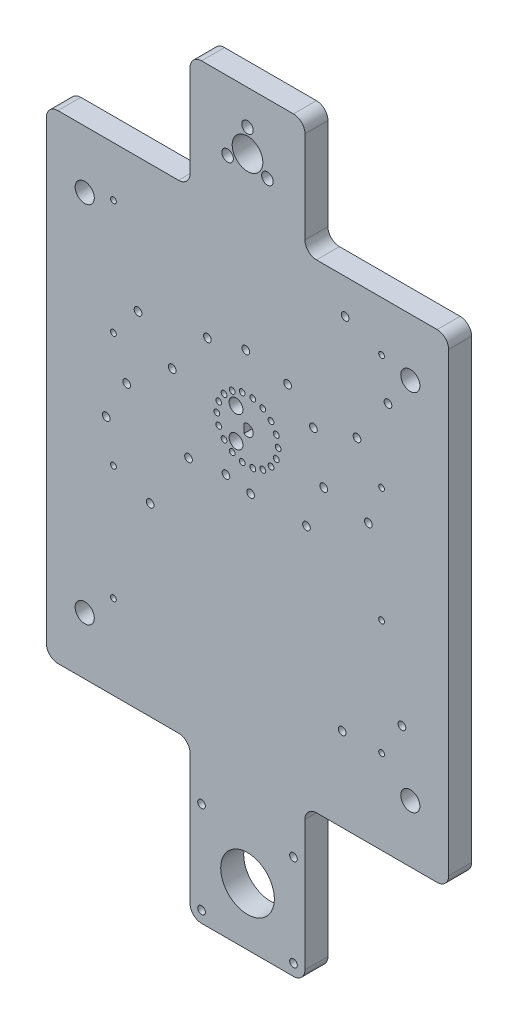
from build123d import *

# Parameters (mm, degrees)
SKETCH_1_W                      = 105
SKETCH_1_H                      = 125
EXTRUDE_1_DEPTH                 = 6
CUT_EXTRUDE_1_REACH             = 165.359
SKETCH_2_R                      = 0.75
FILLET_1_R                      = 3
CUT_EXTRUDE_2_REACH             = 165.359
SKETCH_3_R                      = 1.8
CUT_EXTRUDE_2_DIRECTION_2_DEPTH = 164.358501462
CUT_EXTRUDE1_DEPTH              = 164.358501462
CUT_EXTRUDE1_DEPTH_BACK         = 164.358501462
SKETCH1_R                       = 0.75
CUT_EXTRUDE2_REACH              = 165.359
SKETCH2_R                       = 1
BOSS_EXTRUDE1_DEPTH             = 6
CUT_EXTRUDE3_REACH              = 197.668
SKETCH4_R                       = 4
SKETCH4_R_2                     = 1.5
FILLET1_R                       = 3
CUT_EXTRUDE4_REACH              = 197.668
SKETCH5_R                       = 2.5
CUT_EXTRUDE5_REACH              = 197.668
SKETCH6_R                       = 1
SKETCH6_R_2                     = 7
FILLET2_R                       = 3


with BuildPart() as part:
    # 草图1 → 凸台-拉伸1 (new body)
    with BuildSketch(Plane.XY):
        with Locations((52.5, -62.5)):
            Rectangle(SKETCH_1_W, SKETCH_1_H)
    extrude(amount=EXTRUDE_1_DEPTH)

    # 草图2 → 切除-拉伸1 (cut, up to next)
    with BuildSketch(Plane.XY.offset(6), mode=Mode.PRIVATE) as cut_extrude_1_sk1:
        with Locations((17.5, -13)):
            Circle(SKETCH_2_R)
    cut_extrude_1_tool1 = extrude(cut_extrude_1_sk1.sketch, amount=-CUT_EXTRUDE_1_REACH, mode=Mode.PRIVATE) & part.part
    # 草图2 → 切除-拉伸1 (cut, up to next)
    with BuildSketch(Plane.XY.offset(6), mode=Mode.PRIVATE) as cut_extrude_1_sk2:
        with Locations((87.5, -13)):
            Circle(SKETCH_2_R)
    cut_extrude_1_tool2 = extrude(cut_extrude_1_sk2.sketch, amount=-CUT_EXTRUDE_1_REACH, mode=Mode.PRIVATE) & part.part
    # 草图2 → 切除-拉伸1 (cut, up to next)
    with BuildSketch(Plane.XY.offset(6), mode=Mode.PRIVATE) as cut_extrude_1_sk3:
        with Locations((87.5, -43)):
            Circle(SKETCH_2_R)
    cut_extrude_1_tool3 = extrude(cut_extrude_1_sk3.sketch, amount=-CUT_EXTRUDE_1_REACH, mode=Mode.PRIVATE) & part.part
    # 草图2 → 切除-拉伸1 (cut, up to next)
    with BuildSketch(Plane.XY.offset(6), mode=Mode.PRIVATE) as cut_extrude_1_sk4:
        with Locations((87.5, -73)):
            Circle(SKETCH_2_R)
    cut_extrude_1_tool4 = extrude(cut_extrude_1_sk4.sketch, amount=-CUT_EXTRUDE_1_REACH, mode=Mode.PRIVATE) & part.part
    # 草图2 → 切除-拉伸1 (cut, up to next)
    with BuildSketch(Plane.XY.offset(6), mode=Mode.PRIVATE) as cut_extrude_1_sk5:
        with Locations((87.5, -103)):
            Circle(SKETCH_2_R)
    cut_extrude_1_tool5 = extrude(cut_extrude_1_sk5.sketch, amount=-CUT_EXTRUDE_1_REACH, mode=Mode.PRIVATE) & part.part
    # 草图2 → 切除-拉伸1 (cut, up to next)
    with BuildSketch(Plane.XY.offset(6), mode=Mode.PRIVATE) as cut_extrude_1_sk6:
        with Locations((17.5, -43)):
            Circle(SKETCH_2_R)
    cut_extrude_1_tool6 = extrude(cut_extrude_1_sk6.sketch, amount=-CUT_EXTRUDE_1_REACH, mode=Mode.PRIVATE) & part.part
    # 草图2 → 切除-拉伸1 (cut, up to next)
    with BuildSketch(Plane.XY.offset(6), mode=Mode.PRIVATE) as cut_extrude_1_sk7:
        with Locations((17.5, -73)):
            Circle(SKETCH_2_R)
    cut_extrude_1_tool7 = extrude(cut_extrude_1_sk7.sketch, amount=-CUT_EXTRUDE_1_REACH, mode=Mode.PRIVATE) & part.part
    # 草图2 → 切除-拉伸1 (cut, up to next)
    with BuildSketch(Plane.XY.offset(6), mode=Mode.PRIVATE) as cut_extrude_1_sk8:
        with Locations((17.5, -103)):
            Circle(SKETCH_2_R)
    cut_extrude_1_tool8 = extrude(cut_extrude_1_sk8.sketch, amount=-CUT_EXTRUDE_1_REACH, mode=Mode.PRIVATE) & part.part
    add(cut_extrude_1_tool1.solids().sort_by_distance((17.5, -13, 6))[0], mode=Mode.SUBTRACT)
    add(cut_extrude_1_tool2.solids().sort_by_distance((87.5, -13, 6))[0], mode=Mode.SUBTRACT)
    add(cut_extrude_1_tool3.solids().sort_by_distance((87.5, -43, 6))[0], mode=Mode.SUBTRACT)
    add(cut_extrude_1_tool4.solids().sort_by_distance((87.5, -73, 6))[0], mode=Mode.SUBTRACT)
    add(cut_extrude_1_tool5.solids().sort_by_distance((87.5, -103, 6))[0], mode=Mode.SUBTRACT)
    add(cut_extrude_1_tool6.solids().sort_by_distance((17.5, -43, 6))[0], mode=Mode.SUBTRACT)
    add(cut_extrude_1_tool7.solids().sort_by_distance((17.5, -73, 6))[0], mode=Mode.SUBTRACT)
    add(cut_extrude_1_tool8.solids().sort_by_distance((17.5, -103, 6))[0], mode=Mode.SUBTRACT)

    # 圆角1
    fillet_1_edges = [part.edges().sort_by_distance(p)[0] for p in [
        (0, 0, 3),
        (105, 0, 3),
        (105, -125, 3),
        (0, -125, 3),
    ]]
    fillet(fillet_1_edges, radius=FILLET_1_R)

    # 草图3 → 切除-拉伸2 (cut, up to next)
    with BuildSketch(Plane.XY.offset(6), mode=Mode.PRIVATE) as cut_extrude_2_sk1:
        with Locations(Location((49.5, -43.5, 0), (0, 0, 180))):
            Circle(SKETCH_3_R)
    cut_extrude_2_tool1 = extrude(cut_extrude_2_sk1.sketch, amount=-CUT_EXTRUDE_2_REACH, mode=Mode.PRIVATE) & part.part
    # 草图3 → 切除-拉伸2 (cut, up to next)
    with BuildSketch(Plane.XY.offset(6), mode=Mode.PRIVATE) as cut_extrude_2_sk2:
        with Locations(Location((49.5, -51.5, 0), (0, 0, 180))):
            Circle(SKETCH_3_R)
    cut_extrude_2_tool2 = extrude(cut_extrude_2_sk2.sketch, amount=-CUT_EXTRUDE_2_REACH, mode=Mode.PRIVATE) & part.part
    # 草图3 → 切除-拉伸2 (cut, up to next)
    with BuildSketch(Plane.XY.offset(6), mode=Mode.PRIVATE) as cut_extrude_2_sk3:
        with BuildLine():
            Line((51.6, -46.3), (51.6, -48.7))
            ThreePointArc((51.6, -48.7), (54, -47.5), (51.6, -46.3))
        make_face()
    cut_extrude_2_tool3 = extrude(cut_extrude_2_sk3.sketch, amount=-CUT_EXTRUDE_2_REACH, mode=Mode.PRIVATE) & part.part
    add(cut_extrude_2_tool1.solids().sort_by_distance((49.5, -43.5, 6))[0], mode=Mode.SUBTRACT)
    add(cut_extrude_2_tool2.solids().sort_by_distance((49.5, -51.5, 6))[0], mode=Mode.SUBTRACT)
    add(cut_extrude_2_tool3.solids().sort_by_distance((52.690031, -47.5, 6))[0], mode=Mode.SUBTRACT)

    # 草图3 → 切除-拉伸2 direction 2 (cut)
    with BuildSketch(Plane.XY.offset(6)):
        with Locations(Location((49.5, -43.5, 0), (0, 0, 180))):
            Circle(SKETCH_3_R)
        with Locations(Location((49.5, -51.5, 0), (0, 0, 180))):
            Circle(SKETCH_3_R)
        with BuildLine():
            Line((51.6, -46.3), (51.6, -48.7))
            ThreePointArc((51.6, -48.7), (54, -47.5), (51.6, -46.3))
        make_face()
    extrude(amount=CUT_EXTRUDE_2_DIRECTION_2_DEPTH, mode=Mode.SUBTRACT)

    # Sketch1 → Cut-Extrude1 (cut, two sides: drawn at the far end of the back side and taken through both)
    with BuildSketch(Plane.XY.offset(6).offset(-CUT_EXTRUDE1_DEPTH_BACK)):
        with Locations((60.5, -47.5)):
            Circle(SKETCH1_R)
        with Locations((60.017540966, -50.236161147)):
            Circle(SKETCH1_R)
        with Locations((58.628355545, -52.642300877)):
            Circle(SKETCH1_R)
        with Locations((56.5, -54.42820323)):
            Circle(SKETCH1_R)
        with Locations((53.889185421, -55.378462024)):
            Circle(SKETCH1_R)
        with Locations((51.110814579, -55.378462024)):
            Circle(SKETCH1_R)
        with Locations((48.5, -54.42820323)):
            Circle(SKETCH1_R)
        with Locations((46.371644455, -52.642300877)):
            Circle(SKETCH1_R)
        with Locations((44.982459034, -50.236161147)):
            Circle(SKETCH1_R)
        with Locations((44.5, -47.5)):
            Circle(SKETCH1_R)
        with Locations((44.982459034, -44.763838853)):
            Circle(SKETCH1_R)
        with Locations((46.371644455, -42.357699123)):
            Circle(SKETCH1_R)
        with Locations((48.5, -40.57179677)):
            Circle(SKETCH1_R)
        with Locations((51.110814579, -39.621537976)):
            Circle(SKETCH1_R)
        with Locations((53.889185421, -39.621537976)):
            Circle(SKETCH1_R)
        with Locations((56.5, -40.57179677)):
            Circle(SKETCH1_R)
        with Locations((58.628355545, -42.357699123)):
            Circle(SKETCH1_R)
        with Locations((60.017540966, -44.763838853)):
            Circle(SKETCH1_R)
    extrude(amount=CUT_EXTRUDE1_DEPTH + CUT_EXTRUDE1_DEPTH_BACK, mode=Mode.SUBTRACT)

    # Sketch2 → Cut-Extrude2 (cut, up to next)
    with BuildSketch(Plane(origin=(0, 0, 0), x_dir=(-1, 0, 0), z_dir=(0, 0, -1)), mode=Mode.PRIVATE) as cut_extrude2_sk1:
        with Locations((-52.067615127, -29.585989519)):
            Circle(SKETCH2_R)
    cut_extrude2_tool1 = extrude(cut_extrude2_sk1.sketch, amount=-CUT_EXTRUDE2_REACH, mode=Mode.PRIVATE) & part.part
    # Sketch2 → Cut-Extrude2 (cut, up to next)
    with BuildSketch(Plane(origin=(0, 0, 0), x_dir=(-1, 0, 0), z_dir=(0, 0, -1)), mode=Mode.PRIVATE) as cut_extrude2_sk2:
        with Locations((-77.992506667, -9.049358214)):
            Circle(SKETCH2_R)
    cut_extrude2_tool2 = extrude(cut_extrude2_sk2.sketch, amount=-CUT_EXTRUDE2_REACH, mode=Mode.PRIVATE) & part.part
    # Sketch2 → Cut-Extrude2 (cut, up to next)
    with BuildSketch(Plane(origin=(0, 0, 0), x_dir=(-1, 0, 0), z_dir=(0, 0, -1)), mode=Mode.PRIVATE) as cut_extrude2_sk3:
        with Locations((-89.168508169, -23.159531509)):
            Circle(SKETCH2_R)
    cut_extrude2_tool3 = extrude(cut_extrude2_sk3.sketch, amount=-CUT_EXTRUDE2_REACH, mode=Mode.PRIVATE) & part.part
    # Sketch2 → Cut-Extrude2 (cut, up to next)
    with BuildSketch(Plane(origin=(0, 0, 0), x_dir=(-1, 0, 0), z_dir=(0, 0, -1)), mode=Mode.PRIVATE) as cut_extrude2_sk4:
        with Locations((-15.609550232, -62.879417029)):
            Circle(SKETCH2_R)
    cut_extrude2_tool4 = extrude(cut_extrude2_sk4.sketch, amount=-CUT_EXTRUDE2_REACH, mode=Mode.PRIVATE) & part.part
    # Sketch2 → Cut-Extrude2 (cut, up to next)
    with BuildSketch(Plane(origin=(0, 0, 0), x_dir=(-1, 0, 0), z_dir=(0, 0, -1)), mode=Mode.PRIVATE) as cut_extrude2_sk5:
        with Locations((-27.091675985, -76.741624219)):
            Circle(SKETCH2_R)
    cut_extrude2_tool5 = extrude(cut_extrude2_sk5.sketch, amount=-CUT_EXTRUDE2_REACH, mode=Mode.PRIVATE) & part.part
    # Sketch2 → Cut-Extrude2 (cut, up to next)
    with BuildSketch(Plane(origin=(0, 0, 0), x_dir=(-1, 0, 0), z_dir=(0, 0, -1)), mode=Mode.PRIVATE) as cut_extrude2_sk6:
        with Locations((-46.872908802, -60.356744118)):
            Circle(SKETCH2_R)
    cut_extrude2_tool6 = extrude(cut_extrude2_sk6.sketch, amount=-CUT_EXTRUDE2_REACH, mode=Mode.PRIVATE) & part.part
    # Sketch2 → Cut-Extrude2 (cut, up to next)
    with BuildSketch(Plane(origin=(0, 0, 0), x_dir=(-1, 0, 0), z_dir=(0, 0, -1)), mode=Mode.PRIVATE) as cut_extrude2_sk7:
        with Locations((-53.307488675, -61.456401839)):
            Circle(SKETCH2_R)
    cut_extrude2_tool7 = extrude(cut_extrude2_sk7.sketch, amount=-CUT_EXTRUDE2_REACH, mode=Mode.PRIVATE) & part.part
    # Sketch2 → Cut-Extrude2 (cut, up to next)
    with BuildSketch(Plane(origin=(0, 0, 0), x_dir=(-1, 0, 0), z_dir=(0, 0, -1)), mode=Mode.PRIVATE) as cut_extrude2_sk8:
        with Locations((-92.82086687, -94.185899039)):
            Circle(SKETCH2_R)
    cut_extrude2_tool8 = extrude(cut_extrude2_sk8.sketch, amount=-CUT_EXTRUDE2_REACH, mode=Mode.PRIVATE) & part.part
    # Sketch2 → Cut-Extrude2 (cut, up to next)
    with BuildSketch(Plane(origin=(0, 0, 0), x_dir=(-1, 0, 0), z_dir=(0, 0, -1)), mode=Mode.PRIVATE) as cut_extrude2_sk9:
        with Locations((-77.205305366, -103.138789015)):
            Circle(SKETCH2_R)
    cut_extrude2_tool9 = extrude(cut_extrude2_sk9.sketch, amount=-CUT_EXTRUDE2_REACH, mode=Mode.PRIVATE) & part.part
    # Sketch2 → Cut-Extrude2 (cut, up to next)
    with BuildSketch(Plane(origin=(0, 0, 0), x_dir=(-1, 0, 0), z_dir=(0, 0, -1)), mode=Mode.PRIVATE) as cut_extrude2_sk10:
        with Locations((-81.088439495, -34.944449622)):
            Circle(SKETCH2_R)
    cut_extrude2_tool10 = extrude(cut_extrude2_sk10.sketch, amount=-CUT_EXTRUDE2_REACH, mode=Mode.PRIVATE) & part.part
    # Sketch2 → Cut-Extrude2 (cut, up to next)
    with BuildSketch(Plane(origin=(0, 0, 0), x_dir=(-1, 0, 0), z_dir=(0, 0, -1)), mode=Mode.PRIVATE) as cut_extrude2_sk11:
        with Locations((-84.047621267, -52.699540251)):
            Circle(SKETCH2_R)
    cut_extrude2_tool11 = extrude(cut_extrude2_sk11.sketch, amount=-CUT_EXTRUDE2_REACH, mode=Mode.PRIVATE) & part.part
    # Sketch2 → Cut-Extrude2 (cut, up to next)
    with BuildSketch(Plane(origin=(0, 0, 0), x_dir=(-1, 0, 0), z_dir=(0, 0, -1)), mode=Mode.PRIVATE) as cut_extrude2_sk12:
        with Locations((-23.911560505, -34.944449622)):
            Circle(SKETCH2_R)
    cut_extrude2_tool12 = extrude(cut_extrude2_sk12.sketch, amount=-CUT_EXTRUDE2_REACH, mode=Mode.PRIVATE) & part.part
    # Sketch2 → Cut-Extrude2 (cut, up to next)
    with BuildSketch(Plane(origin=(0, 0, 0), x_dir=(-1, 0, 0), z_dir=(0, 0, -1)), mode=Mode.PRIVATE) as cut_extrude2_sk13:
        with Locations((-20.952378733, -52.699540251)):
            Circle(SKETCH2_R)
    cut_extrude2_tool13 = extrude(cut_extrude2_sk13.sketch, amount=-CUT_EXTRUDE2_REACH, mode=Mode.PRIVATE) & part.part
    # Sketch2 → Cut-Extrude2 (cut, up to next)
    with BuildSketch(Plane(origin=(0, 0, 0), x_dir=(-1, 0, 0), z_dir=(0, 0, -1)), mode=Mode.PRIVATE) as cut_extrude2_sk14:
        with Locations((-62.96598481, -31.882096206)):
            Circle(SKETCH2_R)
    cut_extrude2_tool14 = extrude(cut_extrude2_sk14.sketch, amount=-CUT_EXTRUDE2_REACH, mode=Mode.PRIVATE) & part.part
    # Sketch2 → Cut-Extrude2 (cut, up to next)
    with BuildSketch(Plane(origin=(0, 0, 0), x_dir=(-1, 0, 0), z_dir=(0, 0, -1)), mode=Mode.PRIVATE) as cut_extrude2_sk15:
        with Locations((-67.897954429, -61.473913921)):
            Circle(SKETCH2_R)
    cut_extrude2_tool15 = extrude(cut_extrude2_sk15.sketch, amount=-CUT_EXTRUDE2_REACH, mode=Mode.PRIVATE) & part.part
    # Sketch2 → Cut-Extrude2 (cut, up to next)
    with BuildSketch(Plane(origin=(0, 0, 0), x_dir=(-1, 0, 0), z_dir=(0, 0, -1)), mode=Mode.PRIVATE) as cut_extrude2_sk16:
        with Locations((-42.03401519, -31.882096206)):
            Circle(SKETCH2_R)
    cut_extrude2_tool16 = extrude(cut_extrude2_sk16.sketch, amount=-CUT_EXTRUDE2_REACH, mode=Mode.PRIVATE) & part.part
    # Sketch2 → Cut-Extrude2 (cut, up to next)
    with BuildSketch(Plane(origin=(0, 0, 0), x_dir=(-1, 0, 0), z_dir=(0, 0, -1)), mode=Mode.PRIVATE) as cut_extrude2_sk17:
        with Locations((-37.102045571, -61.473913921)):
            Circle(SKETCH2_R)
    cut_extrude2_tool17 = extrude(cut_extrude2_sk17.sketch, amount=-CUT_EXTRUDE2_REACH, mode=Mode.PRIVATE) & part.part
    # Sketch2 → Cut-Extrude2 (cut, up to next)
    with BuildSketch(Plane(origin=(0, 0, 0), x_dir=(-1, 0, 0), z_dir=(0, 0, -1)), mode=Mode.PRIVATE) as cut_extrude2_sk18:
        with Locations((-72.404748825, -50.534212943)):
            Circle(SKETCH2_R)
    cut_extrude2_tool18 = extrude(cut_extrude2_sk18.sketch, amount=-CUT_EXTRUDE2_REACH, mode=Mode.PRIVATE) & part.part
    # Sketch2 → Cut-Extrude2 (cut, up to next)
    with BuildSketch(Plane(origin=(0, 0, 0), x_dir=(-1, 0, 0), z_dir=(0, 0, -1)), mode=Mode.PRIVATE) as cut_extrude2_sk19:
        with Locations((-32.839199548, -43.414046441)):
            Circle(SKETCH2_R)
    cut_extrude2_tool19 = extrude(cut_extrude2_sk19.sketch, amount=-CUT_EXTRUDE2_REACH, mode=Mode.PRIVATE) & part.part
    # Sketch2 → Cut-Extrude2 (cut, up to next)
    with BuildSketch(Plane(origin=(0, 0, 0), x_dir=(-1, 0, 0), z_dir=(0, 0, -1)), mode=Mode.PRIVATE) as cut_extrude2_sk20:
        with Locations((-69.710721853, -38.345029708)):
            Circle(SKETCH2_R)
    cut_extrude2_tool20 = extrude(cut_extrude2_sk20.sketch, amount=-CUT_EXTRUDE2_REACH, mode=Mode.PRIVATE) & part.part
    add(cut_extrude2_tool1.solids().sort_by_distance((52.067615, -29.58599, 0))[0], mode=Mode.SUBTRACT)
    add(cut_extrude2_tool2.solids().sort_by_distance((77.992507, -9.049358, 0))[0], mode=Mode.SUBTRACT)
    add(cut_extrude2_tool3.solids().sort_by_distance((89.168508, -23.159532, 0))[0], mode=Mode.SUBTRACT)
    add(cut_extrude2_tool4.solids().sort_by_distance((15.60955, -62.879417, 0))[0], mode=Mode.SUBTRACT)
    add(cut_extrude2_tool5.solids().sort_by_distance((27.091676, -76.741624, 0))[0], mode=Mode.SUBTRACT)
    add(cut_extrude2_tool6.solids().sort_by_distance((46.872909, -60.356744, 0))[0], mode=Mode.SUBTRACT)
    add(cut_extrude2_tool7.solids().sort_by_distance((53.307489, -61.456402, 0))[0], mode=Mode.SUBTRACT)
    add(cut_extrude2_tool8.solids().sort_by_distance((92.820867, -94.185899, 0))[0], mode=Mode.SUBTRACT)
    add(cut_extrude2_tool9.solids().sort_by_distance((77.205305, -103.138789, 0))[0], mode=Mode.SUBTRACT)
    add(cut_extrude2_tool10.solids().sort_by_distance((81.088439, -34.94445, 0))[0], mode=Mode.SUBTRACT)
    add(cut_extrude2_tool11.solids().sort_by_distance((84.047621, -52.69954, 0))[0], mode=Mode.SUBTRACT)
    add(cut_extrude2_tool12.solids().sort_by_distance((23.911561, -34.94445, 0))[0], mode=Mode.SUBTRACT)
    add(cut_extrude2_tool13.solids().sort_by_distance((20.952379, -52.69954, 0))[0], mode=Mode.SUBTRACT)
    add(cut_extrude2_tool14.solids().sort_by_distance((62.965985, -31.882096, 0))[0], mode=Mode.SUBTRACT)
    add(cut_extrude2_tool15.solids().sort_by_distance((67.897954, -61.473914, 0))[0], mode=Mode.SUBTRACT)
    add(cut_extrude2_tool16.solids().sort_by_distance((42.034015, -31.882096, 0))[0], mode=Mode.SUBTRACT)
    add(cut_extrude2_tool17.solids().sort_by_distance((37.102046, -61.473914, 0))[0], mode=Mode.SUBTRACT)
    add(cut_extrude2_tool18.solids().sort_by_distance((72.404749, -50.534213, 0))[0], mode=Mode.SUBTRACT)
    add(cut_extrude2_tool19.solids().sort_by_distance((32.8392, -43.414046, 0))[0], mode=Mode.SUBTRACT)
    add(cut_extrude2_tool20.solids().sort_by_distance((69.710722, -38.34503, 0))[0], mode=Mode.SUBTRACT)

    # Sketch3 → Boss-Extrude1 (add)
    with BuildSketch(Plane(origin=(0, 0, 0), x_dir=(-1, 0, 0), z_dir=(0, 0, -1))):
        Polygon((-52.5, 0), (-37.5, 0), (-37.5, 30), (-67.5, 30), (-67.5, 0), align=None)
        Polygon((-52.5, -125), (-37.5, -125), (-37.5, -165), (-67.5, -165), (-67.5, -125), align=None)
    extrude(amount=-BOSS_EXTRUDE1_DEPTH)

    # Sketch4 → Cut-Extrude3 (cut, up to next)
    with BuildSketch(Plane(origin=(0, 0, 0), x_dir=(-1, 0, 0), z_dir=(0, 0, -1)), mode=Mode.PRIVATE) as cut_extrude3_sk1:
        with Locations((-52.5, 15)):
            Circle(SKETCH4_R)
    cut_extrude3_tool1 = extrude(cut_extrude3_sk1.sketch, amount=-CUT_EXTRUDE3_REACH, mode=Mode.PRIVATE) & part.part
    # Sketch4 → Cut-Extrude3 (cut, up to next)
    with BuildSketch(Plane(origin=(0, 0, 0), x_dir=(-1, 0, 0), z_dir=(0, 0, -1)), mode=Mode.PRIVATE) as cut_extrude3_sk2:
        with Locations((-52.5, 21)):
            Circle(SKETCH4_R_2)
    cut_extrude3_tool2 = extrude(cut_extrude3_sk2.sketch, amount=-CUT_EXTRUDE3_REACH, mode=Mode.PRIVATE) & part.part
    # Sketch4 → Cut-Extrude3 (cut, up to next)
    with BuildSketch(Plane(origin=(0, 0, 0), x_dir=(-1, 0, 0), z_dir=(0, 0, -1)), mode=Mode.PRIVATE) as cut_extrude3_sk3:
        with Locations((-47.303847577, 12)):
            Circle(SKETCH4_R_2)
    cut_extrude3_tool3 = extrude(cut_extrude3_sk3.sketch, amount=-CUT_EXTRUDE3_REACH, mode=Mode.PRIVATE) & part.part
    # Sketch4 → Cut-Extrude3 (cut, up to next)
    with BuildSketch(Plane(origin=(0, 0, 0), x_dir=(-1, 0, 0), z_dir=(0, 0, -1)), mode=Mode.PRIVATE) as cut_extrude3_sk4:
        with Locations((-57.696152423, 12)):
            Circle(SKETCH4_R_2)
    cut_extrude3_tool4 = extrude(cut_extrude3_sk4.sketch, amount=-CUT_EXTRUDE3_REACH, mode=Mode.PRIVATE) & part.part
    add(cut_extrude3_tool1.solids().sort_by_distance((52.5, 15, 0))[0], mode=Mode.SUBTRACT)
    add(cut_extrude3_tool2.solids().sort_by_distance((52.5, 21, 0))[0], mode=Mode.SUBTRACT)
    add(cut_extrude3_tool3.solids().sort_by_distance((47.303848, 12, 0))[0], mode=Mode.SUBTRACT)
    add(cut_extrude3_tool4.solids().sort_by_distance((57.696152, 12, 0))[0], mode=Mode.SUBTRACT)

    # Fillet1
    fillet1_edges = [part.edges().sort_by_distance(p)[0] for p in [
        (67.5, 0, 3),
        (67.5, 30, 3),
        (37.5, 30, 3),
        (37.5, 0, 3),
    ]]
    fillet(fillet1_edges, radius=FILLET1_R)

    # Sketch5 → Cut-Extrude4 (cut, up to next)
    with BuildSketch(Plane(origin=(0, 0, 0), x_dir=(-1, 0, 0), z_dir=(0, 0, -1)), mode=Mode.PRIVATE) as cut_extrude4_sk1:
        with Locations((-95, -15)):
            Circle(SKETCH5_R)
    cut_extrude4_tool1 = extrude(cut_extrude4_sk1.sketch, amount=-CUT_EXTRUDE4_REACH, mode=Mode.PRIVATE) & part.part
    # Sketch5 → Cut-Extrude4 (cut, up to next)
    with BuildSketch(Plane(origin=(0, 0, 0), x_dir=(-1, 0, 0), z_dir=(0, 0, -1)), mode=Mode.PRIVATE) as cut_extrude4_sk2:
        with Locations((-95, -110)):
            Circle(SKETCH5_R)
    cut_extrude4_tool2 = extrude(cut_extrude4_sk2.sketch, amount=-CUT_EXTRUDE4_REACH, mode=Mode.PRIVATE) & part.part
    # Sketch5 → Cut-Extrude4 (cut, up to next)
    with BuildSketch(Plane(origin=(0, 0, 0), x_dir=(-1, 0, 0), z_dir=(0, 0, -1)), mode=Mode.PRIVATE) as cut_extrude4_sk3:
        with Locations((-10, -15)):
            Circle(SKETCH5_R)
    cut_extrude4_tool3 = extrude(cut_extrude4_sk3.sketch, amount=-CUT_EXTRUDE4_REACH, mode=Mode.PRIVATE) & part.part
    # Sketch5 → Cut-Extrude4 (cut, up to next)
    with BuildSketch(Plane(origin=(0, 0, 0), x_dir=(-1, 0, 0), z_dir=(0, 0, -1)), mode=Mode.PRIVATE) as cut_extrude4_sk4:
        with Locations((-10, -110)):
            Circle(SKETCH5_R)
    cut_extrude4_tool4 = extrude(cut_extrude4_sk4.sketch, amount=-CUT_EXTRUDE4_REACH, mode=Mode.PRIVATE) & part.part
    add(cut_extrude4_tool1.solids().sort_by_distance((95, -15, 0))[0], mode=Mode.SUBTRACT)
    add(cut_extrude4_tool2.solids().sort_by_distance((95, -110, 0))[0], mode=Mode.SUBTRACT)
    add(cut_extrude4_tool3.solids().sort_by_distance((10, -15, 0))[0], mode=Mode.SUBTRACT)
    add(cut_extrude4_tool4.solids().sort_by_distance((10, -110, 0))[0], mode=Mode.SUBTRACT)

    # Sketch6 → Cut-Extrude5 (cut, up to next)
    with BuildSketch(Plane(origin=(0, 0, 0), x_dir=(-1, 0, 0), z_dir=(0, 0, -1)), mode=Mode.PRIVATE) as cut_extrude5_sk1:
        with Locations((-64.5, -138)):
            Circle(SKETCH6_R)
    cut_extrude5_tool1 = extrude(cut_extrude5_sk1.sketch, amount=-CUT_EXTRUDE5_REACH, mode=Mode.PRIVATE) & part.part
    # Sketch6 → Cut-Extrude5 (cut, up to next)
    with BuildSketch(Plane(origin=(0, 0, 0), x_dir=(-1, 0, 0), z_dir=(0, 0, -1)), mode=Mode.PRIVATE) as cut_extrude5_sk2:
        with Locations((-40.5, -138)):
            Circle(SKETCH6_R)
    cut_extrude5_tool2 = extrude(cut_extrude5_sk2.sketch, amount=-CUT_EXTRUDE5_REACH, mode=Mode.PRIVATE) & part.part
    # Sketch6 → Cut-Extrude5 (cut, up to next)
    with BuildSketch(Plane(origin=(0, 0, 0), x_dir=(-1, 0, 0), z_dir=(0, 0, -1)), mode=Mode.PRIVATE) as cut_extrude5_sk3:
        with Locations((-64.5, -162)):
            Circle(SKETCH6_R)
    cut_extrude5_tool3 = extrude(cut_extrude5_sk3.sketch, amount=-CUT_EXTRUDE5_REACH, mode=Mode.PRIVATE) & part.part
    # Sketch6 → Cut-Extrude5 (cut, up to next)
    with BuildSketch(Plane(origin=(0, 0, 0), x_dir=(-1, 0, 0), z_dir=(0, 0, -1)), mode=Mode.PRIVATE) as cut_extrude5_sk4:
        with Locations((-40.5, -162)):
            Circle(SKETCH6_R)
    cut_extrude5_tool4 = extrude(cut_extrude5_sk4.sketch, amount=-CUT_EXTRUDE5_REACH, mode=Mode.PRIVATE) & part.part
    # Sketch6 → Cut-Extrude5 (cut, up to next)
    with BuildSketch(Plane(origin=(0, 0, 0), x_dir=(-1, 0, 0), z_dir=(0, 0, -1)), mode=Mode.PRIVATE) as cut_extrude5_sk5:
        with Locations((-52.5, -150)):
            Circle(SKETCH6_R_2)
    cut_extrude5_tool5 = extrude(cut_extrude5_sk5.sketch, amount=-CUT_EXTRUDE5_REACH, mode=Mode.PRIVATE) & part.part
    add(cut_extrude5_tool1.solids().sort_by_distance((64.5, -138, 0))[0], mode=Mode.SUBTRACT)
    add(cut_extrude5_tool2.solids().sort_by_distance((40.5, -138, 0))[0], mode=Mode.SUBTRACT)
    add(cut_extrude5_tool3.solids().sort_by_distance((64.5, -162, 0))[0], mode=Mode.SUBTRACT)
    add(cut_extrude5_tool4.solids().sort_by_distance((40.5, -162, 0))[0], mode=Mode.SUBTRACT)
    add(cut_extrude5_tool5.solids().sort_by_distance((52.5, -150, 0))[0], mode=Mode.SUBTRACT)

    # Fillet2
    fillet2_edges = [part.edges().sort_by_distance(p)[0] for p in [
        (67.5, -125, 3),
        (37.5, -125, 3),
        (37.5, -165, 3),
        (67.5, -165, 3),
    ]]
    fillet(fillet2_edges, radius=FILLET2_R)


solid = part.part
